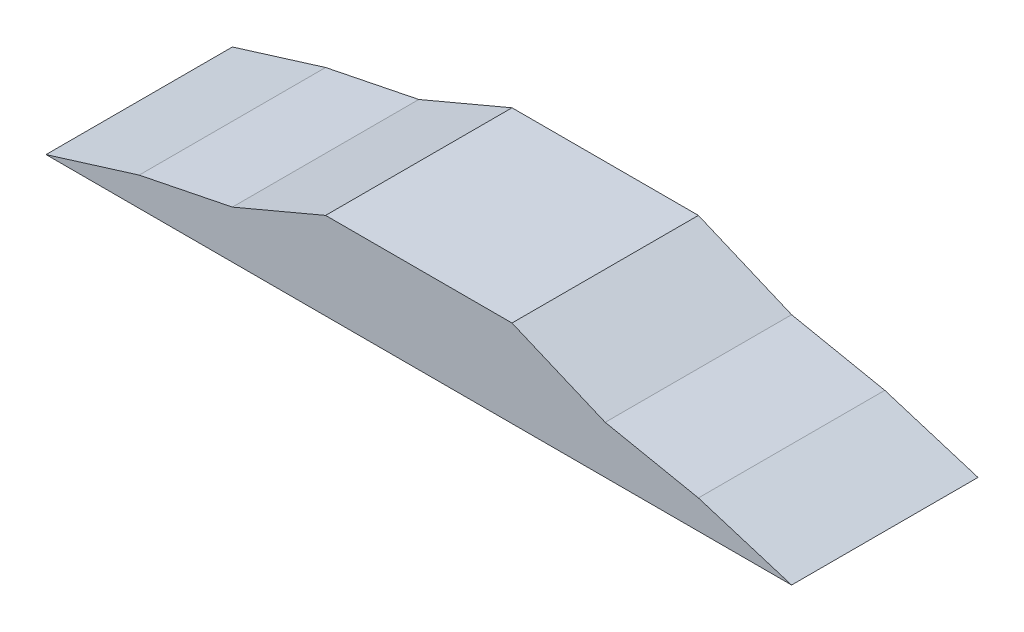
from build123d import *

# Parameters (mm, degrees)
EXTRUDE_1_DEPTH = 100


with BuildPart() as part:
    # 草图1 → 凸台-拉伸1 (new body)
    with BuildSketch(Plane.XY):
        Polygon((-150, 15.46681248), (-100, 25.602314256), (-50, 46.741975193), (50, 46.741975193), (100, 25.602314256), (150, 15.46681248), (200, 0), (-200, 0), align=None)
    extrude(amount=EXTRUDE_1_DEPTH)


solid = part.part
